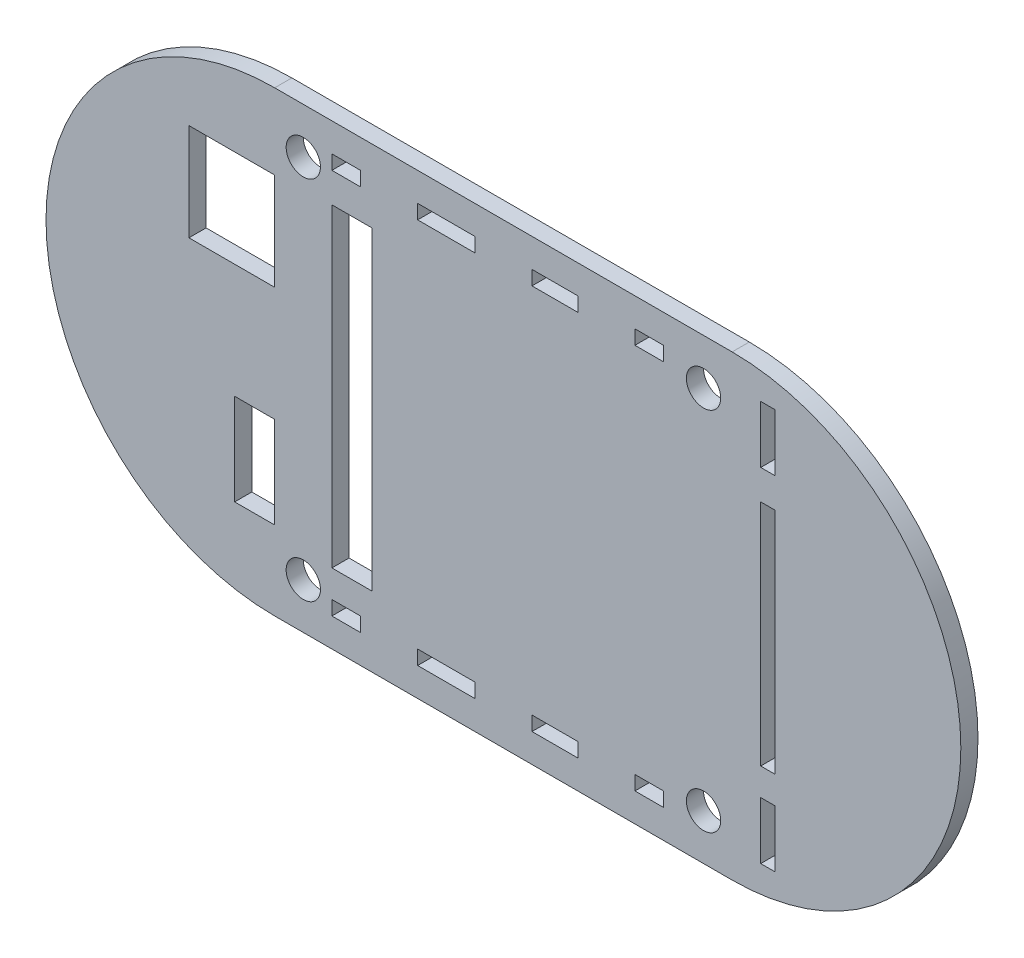
from build123d import *

# Parameters (mm, degrees)
BOSS_EXTRUDE1_DEPTH = 3
CUT_EXTRUDE1_REACH  = 91.591
SKETCH2_R           = 3
SKETCH2_W           = 7
SKETCH2_H           = 55
SKETCH2_W_2         = 2.5
SKETCH2_H_2         = 40
SKETCH2_H_3         = 10
SKETCH2_W_3         = 5
SKETCH2_H_4         = 2.5
SKETCH2_W_4         = 8
SKETCH2_W_5         = 10
SKETCH2_H_5         = 16
SKETCH2_W_6         = 15
SKETCH2_H_6         = 17


with BuildPart() as part:
    # Sketch1 → Boss-Extrude1 (new body)
    with BuildSketch(Plane.XY):
        with BuildLine():
            Line((40, 40.219178082), (-40, 40.219178082))
            ThreePointArc((-40, 40.219178082), (-80, 0.219178082), (-40, -39.780821918))
            Line((-40, -39.780821918), (40, -39.780821918))
            ThreePointArc((40, -39.780821918), (80, 0.219178082), (40, 40.219178082))
        make_face()
    extrude(amount=BOSS_EXTRUDE1_DEPTH)

    # Sketch2 → Cut-Extrude1 (cut, up to next)
    with BuildSketch(Plane(origin=(0, 0, 0), x_dir=(-1, 0, 0), z_dir=(0, 0, -1)), mode=Mode.PRIVATE) as cut_extrude1_sk1:
        with Locations((-35, 32.219178082)):
            Circle(SKETCH2_R)
    cut_extrude1_tool1 = extrude(cut_extrude1_sk1.sketch, amount=-CUT_EXTRUDE1_REACH, mode=Mode.PRIVATE) & part.part
    # Sketch2 → Cut-Extrude1 (cut, up to next)
    with BuildSketch(Plane(origin=(0, 0, 0), x_dir=(-1, 0, 0), z_dir=(0, 0, -1)), mode=Mode.PRIVATE) as cut_extrude1_sk2:
        with Locations((-35, -31.780821918)):
            Circle(SKETCH2_R)
    cut_extrude1_tool2 = extrude(cut_extrude1_sk2.sketch, amount=-CUT_EXTRUDE1_REACH, mode=Mode.PRIVATE) & part.part
    # Sketch2 → Cut-Extrude1 (cut, up to next)
    with BuildSketch(Plane(origin=(0, 0, 0), x_dir=(-1, 0, 0), z_dir=(0, 0, -1)), mode=Mode.PRIVATE) as cut_extrude1_sk3:
        with Locations((35, 32.219178082)):
            Circle(SKETCH2_R)
    cut_extrude1_tool3 = extrude(cut_extrude1_sk3.sketch, amount=-CUT_EXTRUDE1_REACH, mode=Mode.PRIVATE) & part.part
    # Sketch2 → Cut-Extrude1 (cut, up to next)
    with BuildSketch(Plane(origin=(0, 0, 0), x_dir=(-1, 0, 0), z_dir=(0, 0, -1)), mode=Mode.PRIVATE) as cut_extrude1_sk4:
        with Locations((35, -31.780821918)):
            Circle(SKETCH2_R)
    cut_extrude1_tool4 = extrude(cut_extrude1_sk4.sketch, amount=-CUT_EXTRUDE1_REACH, mode=Mode.PRIVATE) & part.part
    # Sketch2 → Cut-Extrude1 (cut, up to next)
    with BuildSketch(Plane(origin=(0, 0, 0), x_dir=(-1, 0, 0), z_dir=(0, 0, -1)), mode=Mode.PRIVATE) as cut_extrude1_sk5:
        with Locations((26.5, 0)):
            Rectangle(SKETCH2_W, SKETCH2_H)
    cut_extrude1_tool5 = extrude(cut_extrude1_sk5.sketch, amount=-CUT_EXTRUDE1_REACH, mode=Mode.PRIVATE) & part.part
    # Sketch2 → Cut-Extrude1 (cut, up to next)
    with BuildSketch(Plane(origin=(0, 0, 0), x_dir=(-1, 0, 0), z_dir=(0, 0, -1)), mode=Mode.PRIVATE) as cut_extrude1_sk6:
        with Locations((-46.25, 0)):
            Rectangle(SKETCH2_W_2, SKETCH2_H_2)
    cut_extrude1_tool6 = extrude(cut_extrude1_sk6.sketch, amount=-CUT_EXTRUDE1_REACH, mode=Mode.PRIVATE) & part.part
    # Sketch2 → Cut-Extrude1 (cut, up to next)
    with BuildSketch(Plane(origin=(0, 0, 0), x_dir=(-1, 0, 0), z_dir=(0, 0, -1)), mode=Mode.PRIVATE) as cut_extrude1_sk7:
        with Locations((-46.25, 30.219178082)):
            Rectangle(SKETCH2_W_2, SKETCH2_H_3)
    cut_extrude1_tool7 = extrude(cut_extrude1_sk7.sketch, amount=-CUT_EXTRUDE1_REACH, mode=Mode.PRIVATE) & part.part
    # Sketch2 → Cut-Extrude1 (cut, up to next)
    with BuildSketch(Plane(origin=(0, 0, 0), x_dir=(-1, 0, 0), z_dir=(0, 0, -1)), mode=Mode.PRIVATE) as cut_extrude1_sk8:
        with Locations((-46.25, -29.780821918)):
            Rectangle(SKETCH2_W_2, SKETCH2_H_3)
    cut_extrude1_tool8 = extrude(cut_extrude1_sk8.sketch, amount=-CUT_EXTRUDE1_REACH, mode=Mode.PRIVATE) & part.part
    # Sketch2 → Cut-Extrude1 (cut, up to next)
    with BuildSketch(Plane(origin=(0, 0, 0), x_dir=(-1, 0, 0), z_dir=(0, 0, -1)), mode=Mode.PRIVATE) as cut_extrude1_sk9:
        with Locations((27.5, 33.969178082)):
            Rectangle(SKETCH2_W_3, SKETCH2_H_4)
    cut_extrude1_tool9 = extrude(cut_extrude1_sk9.sketch, amount=-CUT_EXTRUDE1_REACH, mode=Mode.PRIVATE) & part.part
    # Sketch2 → Cut-Extrude1 (cut, up to next)
    with BuildSketch(Plane(origin=(0, 0, 0), x_dir=(-1, 0, 0), z_dir=(0, 0, -1)), mode=Mode.PRIVATE) as cut_extrude1_sk10:
        with Locations((27.5, -33.530821918)):
            Rectangle(SKETCH2_W_3, SKETCH2_H_4)
    cut_extrude1_tool10 = extrude(cut_extrude1_sk10.sketch, amount=-CUT_EXTRUDE1_REACH, mode=Mode.PRIVATE) & part.part
    # Sketch2 → Cut-Extrude1 (cut, up to next)
    with BuildSketch(Plane(origin=(0, 0, 0), x_dir=(-1, 0, 0), z_dir=(0, 0, -1)), mode=Mode.PRIVATE) as cut_extrude1_sk11:
        with Locations((-25.5, 33.969178082)):
            Rectangle(SKETCH2_W_3, SKETCH2_H_4)
    cut_extrude1_tool11 = extrude(cut_extrude1_sk11.sketch, amount=-CUT_EXTRUDE1_REACH, mode=Mode.PRIVATE) & part.part
    # Sketch2 → Cut-Extrude1 (cut, up to next)
    with BuildSketch(Plane(origin=(0, 0, 0), x_dir=(-1, 0, 0), z_dir=(0, 0, -1)), mode=Mode.PRIVATE) as cut_extrude1_sk12:
        with Locations((-9, 33.969178082)):
            Rectangle(SKETCH2_W_4, SKETCH2_H_4)
    cut_extrude1_tool12 = extrude(cut_extrude1_sk12.sketch, amount=-CUT_EXTRUDE1_REACH, mode=Mode.PRIVATE) & part.part
    # Sketch2 → Cut-Extrude1 (cut, up to next)
    with BuildSketch(Plane(origin=(0, 0, 0), x_dir=(-1, 0, 0), z_dir=(0, 0, -1)), mode=Mode.PRIVATE) as cut_extrude1_sk13:
        with Locations((10, 33.969178082)):
            Rectangle(SKETCH2_W_5, SKETCH2_H_4)
    cut_extrude1_tool13 = extrude(cut_extrude1_sk13.sketch, amount=-CUT_EXTRUDE1_REACH, mode=Mode.PRIVATE) & part.part
    # Sketch2 → Cut-Extrude1 (cut, up to next)
    with BuildSketch(Plane(origin=(0, 0, 0), x_dir=(-1, 0, 0), z_dir=(0, 0, -1)), mode=Mode.PRIVATE) as cut_extrude1_sk14:
        with Locations((-25.5, -33.530821918)):
            Rectangle(SKETCH2_W_3, SKETCH2_H_4)
    cut_extrude1_tool14 = extrude(cut_extrude1_sk14.sketch, amount=-CUT_EXTRUDE1_REACH, mode=Mode.PRIVATE) & part.part
    # Sketch2 → Cut-Extrude1 (cut, up to next)
    with BuildSketch(Plane(origin=(0, 0, 0), x_dir=(-1, 0, 0), z_dir=(0, 0, -1)), mode=Mode.PRIVATE) as cut_extrude1_sk15:
        with Locations((-9, -33.530821918)):
            Rectangle(SKETCH2_W_4, SKETCH2_H_4)
    cut_extrude1_tool15 = extrude(cut_extrude1_sk15.sketch, amount=-CUT_EXTRUDE1_REACH, mode=Mode.PRIVATE) & part.part
    # Sketch2 → Cut-Extrude1 (cut, up to next)
    with BuildSketch(Plane(origin=(0, 0, 0), x_dir=(-1, 0, 0), z_dir=(0, 0, -1)), mode=Mode.PRIVATE) as cut_extrude1_sk16:
        with Locations((10, -33.530821918)):
            Rectangle(SKETCH2_W_5, SKETCH2_H_4)
    cut_extrude1_tool16 = extrude(cut_extrude1_sk16.sketch, amount=-CUT_EXTRUDE1_REACH, mode=Mode.PRIVATE) & part.part
    # Sketch2 → Cut-Extrude1 (cut, up to next)
    with BuildSketch(Plane(origin=(0, 0, 0), x_dir=(-1, 0, 0), z_dir=(0, 0, -1)), mode=Mode.PRIVATE) as cut_extrude1_sk17:
        with Locations((43.5, -18)):
            Rectangle(SKETCH2_W, SKETCH2_H_5)
    cut_extrude1_tool17 = extrude(cut_extrude1_sk17.sketch, amount=-CUT_EXTRUDE1_REACH, mode=Mode.PRIVATE) & part.part
    # Sketch2 → Cut-Extrude1 (cut, up to next)
    with BuildSketch(Plane(origin=(0, 0, 0), x_dir=(-1, 0, 0), z_dir=(0, 0, -1)), mode=Mode.PRIVATE) as cut_extrude1_sk18:
        with Locations((47.5, 18.5)):
            Rectangle(SKETCH2_W_6, SKETCH2_H_6)
    cut_extrude1_tool18 = extrude(cut_extrude1_sk18.sketch, amount=-CUT_EXTRUDE1_REACH, mode=Mode.PRIVATE) & part.part
    add(cut_extrude1_tool1.solids().sort_by_distance((35, 32.219178, 0))[0], mode=Mode.SUBTRACT)
    add(cut_extrude1_tool2.solids().sort_by_distance((35, -31.780822, 0))[0], mode=Mode.SUBTRACT)
    add(cut_extrude1_tool3.solids().sort_by_distance((-35, 32.219178, 0))[0], mode=Mode.SUBTRACT)
    add(cut_extrude1_tool4.solids().sort_by_distance((-35, -31.780822, 0))[0], mode=Mode.SUBTRACT)
    add(cut_extrude1_tool5.solids().sort_by_distance((-26.5, 0, 0))[0], mode=Mode.SUBTRACT)
    add(cut_extrude1_tool6.solids().sort_by_distance((46.25, 0, 0))[0], mode=Mode.SUBTRACT)
    add(cut_extrude1_tool7.solids().sort_by_distance((46.25, 30.219178, 0))[0], mode=Mode.SUBTRACT)
    add(cut_extrude1_tool8.solids().sort_by_distance((46.25, -29.780822, 0))[0], mode=Mode.SUBTRACT)
    add(cut_extrude1_tool9.solids().sort_by_distance((-27.5, 33.969178, 0))[0], mode=Mode.SUBTRACT)
    add(cut_extrude1_tool10.solids().sort_by_distance((-27.5, -33.530822, 0))[0], mode=Mode.SUBTRACT)
    add(cut_extrude1_tool11.solids().sort_by_distance((25.5, 33.969178, 0))[0], mode=Mode.SUBTRACT)
    add(cut_extrude1_tool12.solids().sort_by_distance((9, 33.969178, 0))[0], mode=Mode.SUBTRACT)
    add(cut_extrude1_tool13.solids().sort_by_distance((-10, 33.969178, 0))[0], mode=Mode.SUBTRACT)
    add(cut_extrude1_tool14.solids().sort_by_distance((25.5, -33.530822, 0))[0], mode=Mode.SUBTRACT)
    add(cut_extrude1_tool15.solids().sort_by_distance((9, -33.530822, 0))[0], mode=Mode.SUBTRACT)
    add(cut_extrude1_tool16.solids().sort_by_distance((-10, -33.530822, 0))[0], mode=Mode.SUBTRACT)
    add(cut_extrude1_tool17.solids().sort_by_distance((-43.5, -18, 0))[0], mode=Mode.SUBTRACT)
    add(cut_extrude1_tool18.solids().sort_by_distance((-47.5, 18.5, 0))[0], mode=Mode.SUBTRACT)


solid = part.part
